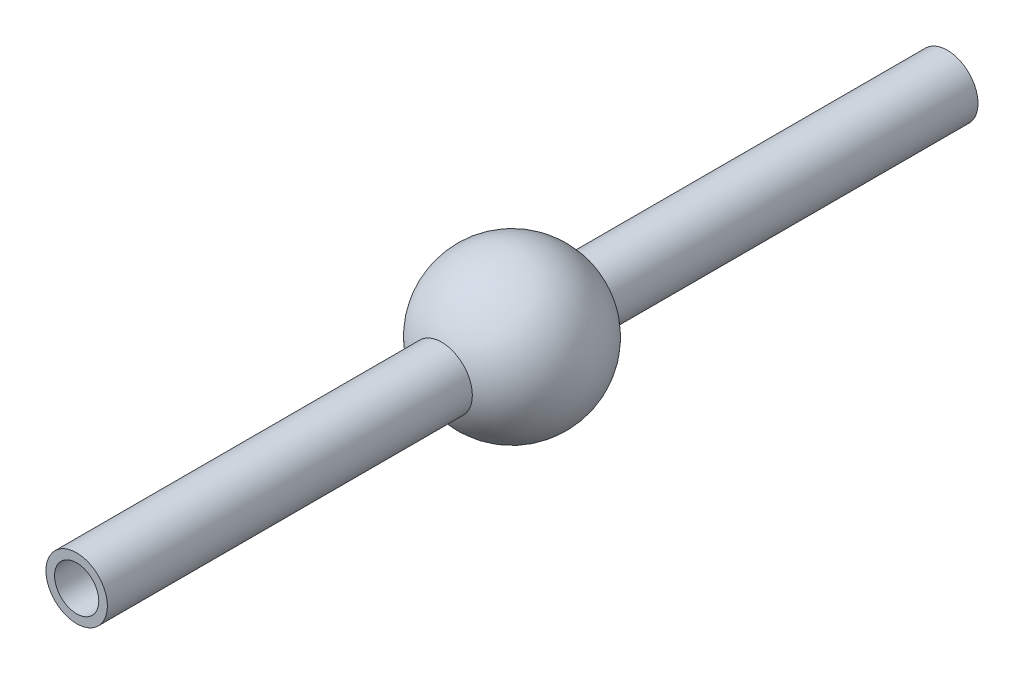
from build123d import *

# Parameters (mm, degrees)
CUT_EXTRUDE1_DEPTH       = 14.743823158
CUT_EXTRUDE1_DEPTH_BACK  = 14.743823158
SKETCH4_R                = 3.175
BOSS_EXTRUDE1_DEPTH      = 45
BOSS_EXTRUDE1_DEPTH_BACK = 45
SKETCH5_R                = 3.175
SKETCH5_R_2              = 2.286


with BuildPart() as part:
    # Sketch3 → Revolve3 (revolve)
    with BuildSketch(Plane(origin=(0, 0, 0), x_dir=(1, 0, 0), z_dir=(0, 1, 0))):
        with BuildLine():
            Line((0, -7.935), (0, 7.935))
            ThreePointArc((0, 7.935), (-7.935, 0), (0, -7.935))
        make_face()
    revolve(axis=Axis((0, 0, -12.438098035), (0, 0, 1)))

    # Sketch4 → Cut-Extrude1 (cut, two sides: drawn at the far end of the back side and taken through both)
    with BuildSketch(Plane.XY.offset(-CUT_EXTRUDE1_DEPTH_BACK)):
        Circle(SKETCH4_R)
    extrude(amount=CUT_EXTRUDE1_DEPTH + CUT_EXTRUDE1_DEPTH_BACK, mode=Mode.SUBTRACT)

    # Sketch5 → Boss-Extrude1 (add, two sides: drawn at the far end of the back side and taken through both)
    with BuildSketch(Plane.XY.offset(-BOSS_EXTRUDE1_DEPTH_BACK)):
        Circle(SKETCH5_R)
        Circle(SKETCH5_R_2, mode=Mode.SUBTRACT)
    extrude(amount=BOSS_EXTRUDE1_DEPTH + BOSS_EXTRUDE1_DEPTH_BACK)


solid = part.part
